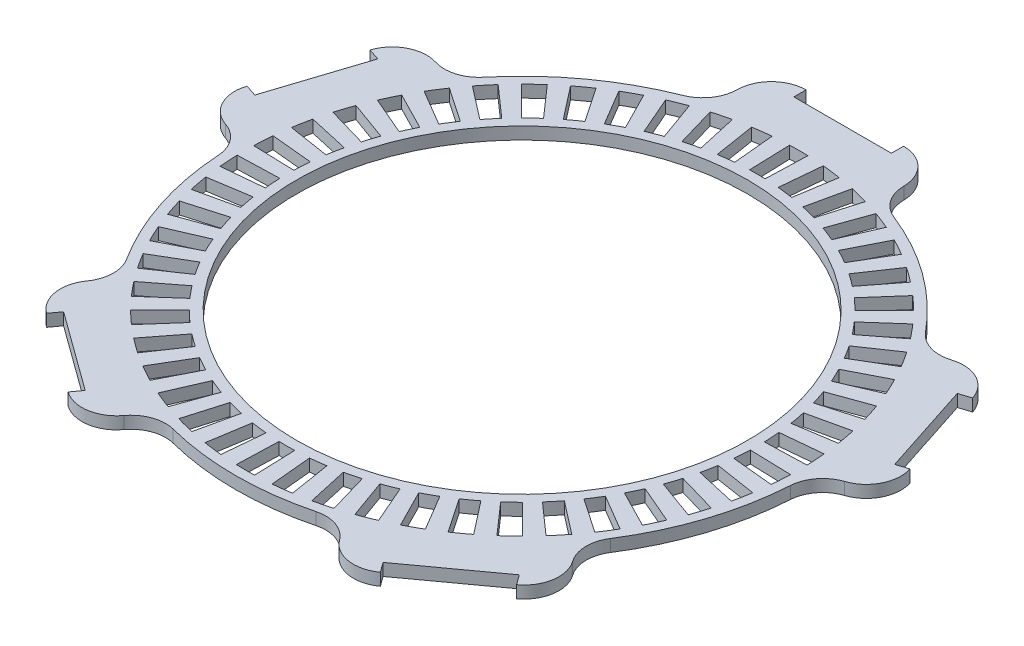
from build123d import *

# Parameters (mm, degrees)
SKETCH1_R                = 23.5
SKETCH1_R_2              = 18.5
BOSS_EXTRUDE1_DEPTH      = 1
CUT_EXTRUDE1_DEPTH       = 34.249060137
CIRPATTERN1_COUNT        = 50
BOSS_EXTRUDE2_START      = -1
BOSS_EXTRUDE2_DEPTH      = 1
CIRPATTERN2_COUNT        = 5
CIRPATTERN2_START        = -1
CIRPATTERN2_COPY_1_DEPTH = 1
CIRPATTERN2_COPY_2_DEPTH = 1
CIRPATTERN2_COPY_3_DEPTH = 1
CIRPATTERN2_COPY_4_DEPTH = 1


with BuildPart() as part:
    # Sketch1 → Boss-Extrude1 (new body)
    with BuildSketch(Plane(origin=(0, 0, 0), x_dir=(1, 0, 0), z_dir=(0, 1, 0))):
        with Locations(Location((0, 0, 0), (0, 0, 270))):
            Circle(SKETCH1_R)
        with Locations(Location((0, 0, 0), (0, 0, 270))):
            Circle(SKETCH1_R_2, mode=Mode.SUBTRACT)
    extrude(amount=BOSS_EXTRUDE1_DEPTH)

    # Sketch2 → Cut-Extrude1 (cut, through all)
    with BuildSketch(Plane(origin=(0, 1, 0), x_dir=(1, 0, 0), z_dir=(0, 1, 0))):
        with BuildLine():
            Line((-0.75, 22.687606749), (-0.637665198, 19.289463007))
            ThreePointArc((-0.637665198, 19.289463007), (0, 19.3), (0.637665198, 19.289463007))
            Line((0.637665198, 19.289463007), (0.75, 22.687606749))
            ThreePointArc((0.75, 22.687606749), (0, 22.7), (-0.75, 22.687606749))
        make_face()
    cut_extrude1 = extrude(amount=-CUT_EXTRUDE1_DEPTH, mode=Mode.SUBTRACT)

    # CirPattern1: Cut-Extrude1 ×50 about axis
    cirpattern1_axis = Axis((0, 0, 0), (0, 1, 0))
    for i in range(1, CIRPATTERN1_COUNT):
        add(cut_extrude1.rotate(cirpattern1_axis, i * 360 / CIRPATTERN1_COUNT), mode=Mode.SUBTRACT)

    # Sketch3 → Boss-Extrude2 (add)
    with BuildSketch(Plane(origin=(0, 1, 0), x_dir=(1, 0, 0), z_dir=(0, 1, 0)).offset(BOSS_EXTRUDE2_START)):
        with BuildLine():
            Line((0, 23.5), (0, 26.286562549))
            Line((0, 26.286562549), (4, 26.286562549))
            Line((4, 26.286562549), (4, 27.286562549))
            ThreePointArc((4, 27.286562549), (6.00004522, 26.46351518), (6.84150647, 24.471147038))
            ThreePointArc((6.84150647, 24.471147038), (7.340609056, 22.888635756), (8.638448982, 21.85468369))
            ThreePointArc((8.638448982, 21.85468369), (4.396870096, 23.085006679), (0, 23.5))
        make_face()
    boss_extrude2 = extrude(amount=BOSS_EXTRUDE2_DEPTH)

    # Mirror1: Boss-Extrude2 across plane
    add(boss_extrude2.mirror(Plane(origin=(0, 0, 0), x_dir=(0, 0, 1), z_dir=(1, 0, 0))))

    # CirPattern2: Boss-Extrude2 ×5 about axis
    cirpattern2_axis = Axis((0, 0, 0), (0, 1, 0))
    for i in range(1, CIRPATTERN2_COUNT):
        add(boss_extrude2.rotate(cirpattern2_axis, i * 360 / CIRPATTERN2_COUNT))

    # CirPattern2 copy 1 sketch → CirPattern2 copy 1 (add)
    with BuildSketch(Plane(origin=(0, 1, 0), x_dir=(-0.30901699437494745, 0, 0.9510565162951535), z_dir=(0, 1, 0)).offset(CIRPATTERN2_START)):
        with BuildLine():
            Line((0, -23.5), (0, -26.286562549))
            Line((0, -26.286562549), (4, -26.286562549))
            Line((4, -26.286562549), (4, -27.286562549))
            ThreePointArc((4, -27.286562549), (6.00004522, -26.46351518), (6.84150647, -24.471147038))
            ThreePointArc((6.84150647, -24.471147038), (7.340609056, -22.888635756), (8.638448982, -21.85468369))
            ThreePointArc((8.638448982, -21.85468369), (4.396870096, -23.085006679), (0, -23.5))
        make_face()
    extrude(amount=CIRPATTERN2_COPY_1_DEPTH)

    # CirPattern2 copy 2 sketch → CirPattern2 copy 2 (add)
    with BuildSketch(Plane(origin=(0, 1, 0), x_dir=(0.8090169943749473, 0, 0.5877852522924732), z_dir=(0, 1, 0)).offset(CIRPATTERN2_START)):
        with BuildLine():
            Line((0, -23.5), (0, -26.286562549))
            Line((0, -26.286562549), (4, -26.286562549))
            Line((4, -26.286562549), (4, -27.286562549))
            ThreePointArc((4, -27.286562549), (6.00004522, -26.46351518), (6.84150647, -24.471147038))
            ThreePointArc((6.84150647, -24.471147038), (7.340609056, -22.888635756), (8.638448982, -21.85468369))
            ThreePointArc((8.638448982, -21.85468369), (4.396870096, -23.085006679), (0, -23.5))
        make_face()
    extrude(amount=CIRPATTERN2_COPY_2_DEPTH)

    # CirPattern2 copy 3 sketch → CirPattern2 copy 3 (add)
    with BuildSketch(Plane(origin=(0, 1, 0), x_dir=(0.8090169943749476, 0, -0.587785252292473), z_dir=(0, 1, 0)).offset(CIRPATTERN2_START)):
        with BuildLine():
            Line((0, -23.5), (0, -26.286562549))
            Line((0, -26.286562549), (4, -26.286562549))
            Line((4, -26.286562549), (4, -27.286562549))
            ThreePointArc((4, -27.286562549), (6.00004522, -26.46351518), (6.84150647, -24.471147038))
            ThreePointArc((6.84150647, -24.471147038), (7.340609056, -22.888635756), (8.638448982, -21.85468369))
            ThreePointArc((8.638448982, -21.85468369), (4.396870096, -23.085006679), (0, -23.5))
        make_face()
    extrude(amount=CIRPATTERN2_COPY_3_DEPTH)

    # CirPattern2 copy 4 sketch → CirPattern2 copy 4 (add)
    with BuildSketch(Plane(origin=(0, 1, 0), x_dir=(-0.30901699437494723, 0, -0.9510565162951536), z_dir=(0, 1, 0)).offset(CIRPATTERN2_START)):
        with BuildLine():
            Line((0, -23.5), (0, -26.286562549))
            Line((0, -26.286562549), (4, -26.286562549))
            Line((4, -26.286562549), (4, -27.286562549))
            ThreePointArc((4, -27.286562549), (6.00004522, -26.46351518), (6.84150647, -24.471147038))
            ThreePointArc((6.84150647, -24.471147038), (7.340609056, -22.888635756), (8.638448982, -21.85468369))
            ThreePointArc((8.638448982, -21.85468369), (4.396870096, -23.085006679), (0, -23.5))
        make_face()
    extrude(amount=CIRPATTERN2_COPY_4_DEPTH)


solid = part.part
